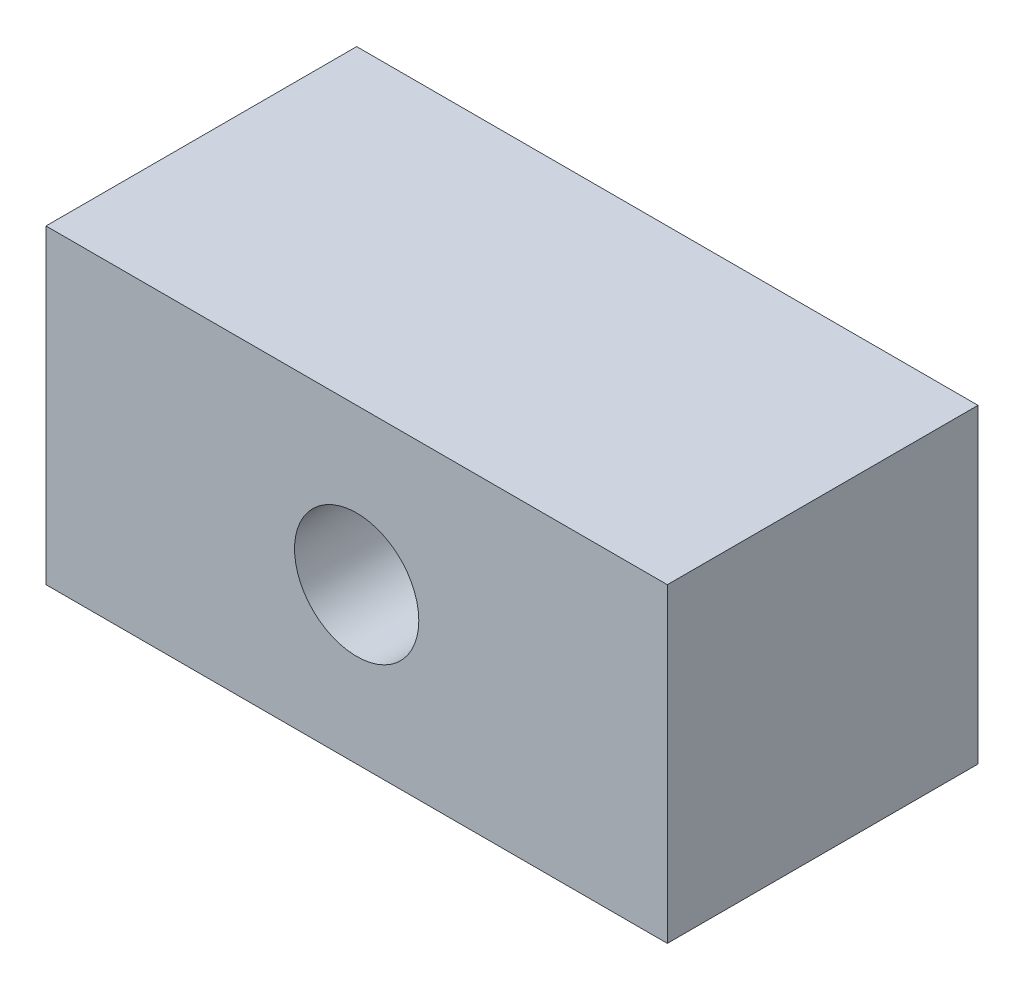
from build123d import *

# Parameters (mm, degrees)
SKETCH1_W               = 40
SKETCH1_H               = 20
BOSS_EXTRUDE1_DEPTH     = 10
CUT_EXTRUDE1_DEPTH      = 46.82575695
CUT_EXTRUDE1_DEPTH_BACK = 46.82575695
SKETCH2_R               = 4


with BuildPart() as part:
    # Sketch1 → Boss-Extrude1 (new, symmetric)
    with BuildSketch(Plane.XY):
        with Locations((20, 10)):
            Rectangle(SKETCH1_W, SKETCH1_H)
    extrude(amount=BOSS_EXTRUDE1_DEPTH, both=True)

    # Sketch2 → Cut-Extrude1 (cut, two sides: drawn at the far end of the back side and taken through both)
    with BuildSketch(Plane.XY.offset(-CUT_EXTRUDE1_DEPTH_BACK)):
        with Locations((20, 10)):
            Circle(SKETCH2_R)
    extrude(amount=CUT_EXTRUDE1_DEPTH + CUT_EXTRUDE1_DEPTH_BACK, mode=Mode.SUBTRACT)


solid = part.part
